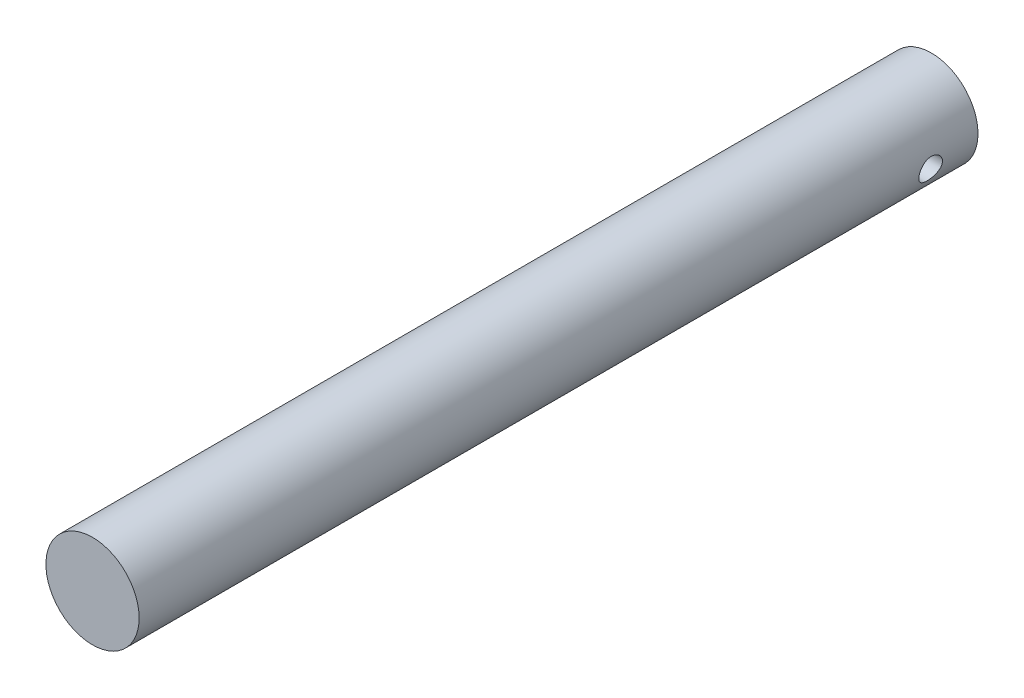
from build123d import *

# Parameters (mm, degrees)
SKETCH1_R           = 6.35
BOSS_EXTRUDE1_DEPTH = 114.3
SKETCH2_R           = 1.5875
CUT_EXTRUDE1_DEPTH  = 23.114


with BuildPart() as part:
    # Sketch1 → Boss-Extrude1 (new body)
    with BuildSketch(Plane.XY):
        with Locations((-5.146673194, 5.633520658)):
            Circle(SKETCH1_R)
    extrude(amount=BOSS_EXTRUDE1_DEPTH)

    # Sketch2 → Cut-Extrude1 (cut)
    with BuildSketch(Plane(origin=(1.203326806, 0, 0), x_dir=(0, 0, -1), z_dir=(1, 0, 0))):
        with Locations((-6.35, 4.533042493)):
            Circle(SKETCH2_R)
    extrude(amount=-CUT_EXTRUDE1_DEPTH, mode=Mode.SUBTRACT)


solid = part.part
